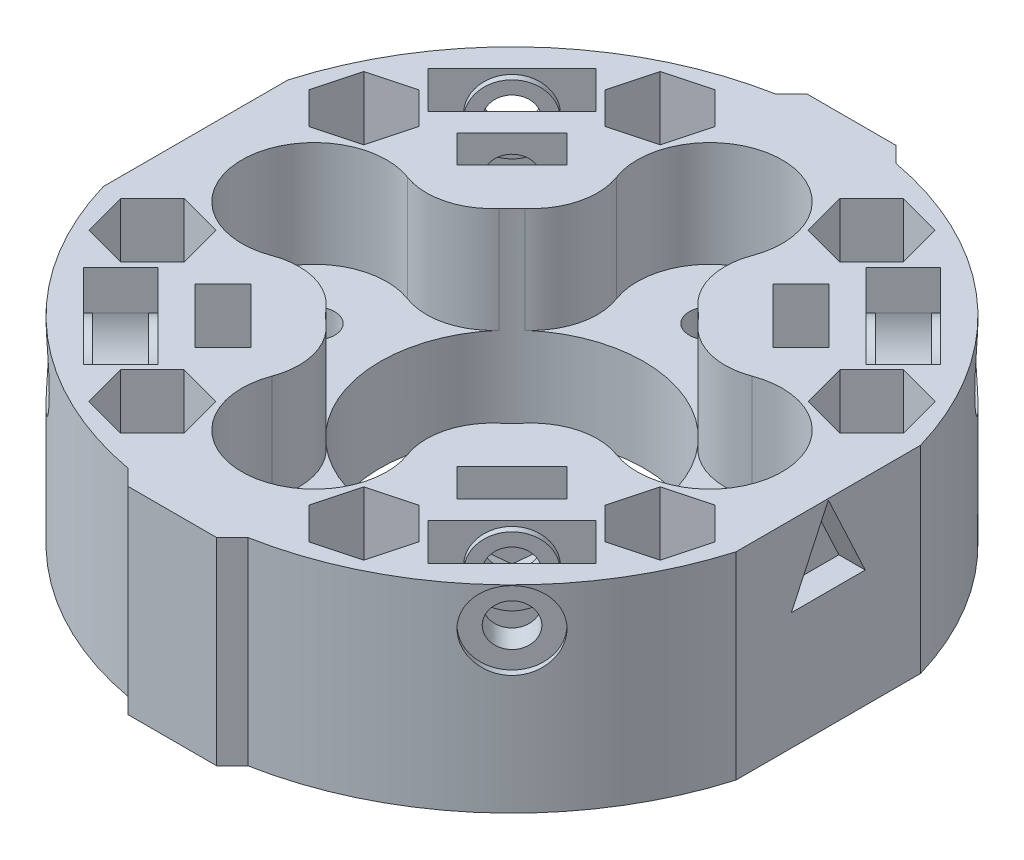
from build123d import *
from build123d.topology import SkipClean

# Parameters (mm, degrees)
SALIENTE_EXTRUIR1_DEPTH = 15
CORTAR_EXTRUIR1_DEPTH   = 4
CORTAR_EXTRUIR2_DEPTH   = 3
CROQUIS5_R              = 1.6
CORTAR_EXTRUIR3_DEPTH   = 55.319838485
CORTAR_EXTRUIR4_DEPTH   = 2
CROQUIS8_R              = 2.95
CORTAR_EXTRUIR5_DEPTH   = 3
CROQUIS10_R             = 2.6
CROQUIS10_R_2           = 1.6
SALIENTE_EXTRUIR2_DEPTH = 0.5
SALIENTE_EXTRUIR3_START = 0.5
CROQUIS11_R             = 2.6
CROQUIS11_R_2           = 1.6
SALIENTE_EXTRUIR3_DEPTH = 0.5
CROQUIS12_R             = 10
CROQUIS12_R_2           = 1.55
CORTAR_EXTRUIR6_DEPTH   = 39.276532076
CORTAR_EXTRUIR7_START   = -8
CROQUIS13_R             = 1.55
CORTAR_EXTRUIR7_DEPTH   = 8
MATRIZC1_COUNT          = 4
CROQUIS14_R             = 2.95
CORTAR_EXTRUIR8_DEPTH   = 3
MATRIZC2_COUNT          = 4
CROQUIS15_R             = 1.5
CORTAR_EXTRUIR9_DEPTH   = 5
MATRIZC3_COUNT          = 4
CROQUIS16_R             = 1.6
CORTAR_EXTRUIR10_DEPTH  = 10
CROQUIS17_R             = 1.6
CORTAR_EXTRUIR11_DEPTH  = 39.276532076
MATRIZC4_COUNT          = 4


with BuildPart() as part:
    # Croquis1 → Saliente-Extruir1 (new body)
    with BuildSketch(Plane(origin=(0, 0, 0), x_dir=(1, 0, 0), z_dir=(0, 1, 0))):
        with BuildLine():
            Line((3.36, 25.77), (-3.36, 25.77))
            Line((-3.36, 25.77), (-4.543554853, 24.583655328))
            ThreePointArc((-4.543554853, 24.583655328), (-16.762454014, 18.547779798), (-24, 7))
            Line((-24, 7), (-24, -7))
            ThreePointArc((-24, -7), (-16.762454014, -18.547779798), (-4.543554853, -24.583655328))
            Line((-4.543554853, -24.583655328), (-3.36, -25.77))
            Line((-3.36, -25.77), (3.36, -25.77))
            Line((3.36, -25.77), (4.543554853, -24.583655328))
            ThreePointArc((4.543554853, -24.583655328), (16.762454014, -18.547779798), (24, -7))
            Line((24, -7), (24, 7))
            ThreePointArc((24, 7), (16.762454014, 18.547779798), (4.543554853, 24.583655328))
            Line((4.543554853, 24.583655328), (3.36, 25.77))
        make_face()
    extrude(amount=SALIENTE_EXTRUIR1_DEPTH)

    # Croquis3 → Cortar-Extruir1 (cut)
    with BuildSketch(Plane(origin=(16.263455967, 0, -16.263455967), x_dir=(0.7071067811865477, 0, 0.7071067811865475), z_dir=(-0.7071067811865475, 0, 0.7071067811865477))):
        with BuildLine():
            Line((-4.5, 12), (-4.5, 15))
            Line((-4.5, 15), (4.5, 15))
            Line((4.5, 15), (4.5, 12))
            ThreePointArc((4.5, 12), (0, 7.5), (-4.5, 12))
        make_face()
    cortar_extruir1 = extrude(amount=CORTAR_EXTRUIR1_DEPTH, mode=Mode.SUBTRACT)

    # Croquis4 → Cortar-Extruir2 (cut)
    with BuildSketch(Plane(origin=(12.02081528, 0, -12.02081528), x_dir=(-0.7071067811865476, 0, -0.7071067811865476), z_dir=(0.7071067811865476, 0, -0.7071067811865476))):
        Polygon((-2.95, 10.296816706), (0, 8.593633412), (2.95, 10.296816706), (2.95, 13.703183294), (2.95, 15), (-2.95, 15), (-2.95, 13.703183294), align=None)
    cortar_extruir2 = extrude(amount=-CORTAR_EXTRUIR2_DEPTH, mode=Mode.SUBTRACT)

    # Croquis5 → Cortar-Extruir3 (cut, through all)
    with BuildSketch(Plane(origin=(12.02081528, 0, -12.02081528), x_dir=(0.7071067811865475, 0, 0.7071067811865477), z_dir=(-0.7071067811865477, 0, 0.7071067811865475))):
        with Locations((0, 12)):
            Circle(CROQUIS5_R)
    cortar_extruir3 = extrude(amount=-CORTAR_EXTRUIR3_DEPTH, mode=Mode.SUBTRACT)

    # Croquis6 → Cortar-Extruir4 (cut)
    with BuildSketch(Plane(origin=(24, 0, 0), x_dir=(0, 0, -1), z_dir=(1, 0, 0))):
        Polygon((0, 14.9), (-2.8, 8.9), (2.8, 8.9), align=None)
    extrude(amount=-CORTAR_EXTRUIR4_DEPTH, mode=Mode.SUBTRACT)

    # Croquis8 → Cortar-Extruir5 (cut)
    with BuildSketch(Plane(origin=(19.445436483, 0, -19.445436483), x_dir=(-0.7071067811865476, 0, -0.7071067811865476), z_dir=(0.7071067811865476, 0, -0.7071067811865476))):
        with Locations((0, 12)):
            Circle(CROQUIS8_R)
    cortar_extruir5 = extrude(amount=-CORTAR_EXTRUIR5_DEPTH, mode=Mode.SUBTRACT)

    # Croquis10 → Saliente-Extruir2 (add)
    with BuildSketch(Plane(origin=(13.435028843, 0, -13.435028843), x_dir=(-0.7071067811865476, 0, -0.7071067811865476), z_dir=(0.7071067811865476, 0, -0.7071067811865476))):
        with Locations(Location((0, 12, 0), (0, 0, 180))):
            Circle(CROQUIS10_R)
        with Locations(Location((0, 12, 0), (0, 0, 180))):
            Circle(CROQUIS10_R_2, mode=Mode.SUBTRACT)
    saliente_extruir2 = extrude(amount=SALIENTE_EXTRUIR2_DEPTH)

    # Croquis11 → Saliente-Extruir3 (add)
    with BuildSketch(Plane(origin=(16.263455967, 0, -16.263455967), x_dir=(0.7071067811865476, 0, 0.7071067811865476), z_dir=(-0.7071067811865476, 0, 0.7071067811865476)).offset(SALIENTE_EXTRUIR3_START)):
        with Locations((0, 12)):
            Circle(CROQUIS11_R)
        with Locations((0, 12)):
            Circle(CROQUIS11_R_2, mode=Mode.SUBTRACT)
    saliente_extruir3 = extrude(amount=-SALIENTE_EXTRUIR3_DEPTH)

    # Croquis12 → Cortar-Extruir6 (cut, through all)
    with BuildSketch(Plane.XZ):
        with Locations(Location((0, 0, 0), (0, 0, 270))):
            Circle(CROQUIS12_R)
        with Locations(Location((0, -15, 0), (0, 0, 270))):
            Circle(CROQUIS12_R_2)
        with Locations(Location((-15, 0, 0), (0, 0, 270))):
            Circle(CROQUIS12_R_2)
        with Locations(Location((0, 15, 0), (0, 0, 270))):
            Circle(CROQUIS12_R_2)
        with Locations(Location((15, 0, 0), (0, 0, 270))):
            Circle(CROQUIS12_R_2)
    extrude(amount=-CORTAR_EXTRUIR6_DEPTH, mode=Mode.SUBTRACT)

    # Croquis13 → Cortar-Extruir7 (cut)
    # profile 1 of 5: a face of its own
    with SkipClean():  # the faces are left unmerged after this step: merging them gives an invalid solid
        with BuildSketch(Plane(origin=(0, 15, 0), x_dir=(1, 0, 0), z_dir=(0, 1, 0)).offset(CORTAR_EXTRUIR7_START)):
            with BuildLine():
                ThreePointArc((-6.557247898, 7.55), (0, 10), (6.557247898, 7.55))
                ThreePointArc((6.557247898, 7.55), (4.990126291, 10.092624246), (5.152123349, 13.075))
                ThreePointArc((5.152123349, 13.075), (0, 20.5), (-5.152123349, 13.075))
                ThreePointArc((-5.152123349, 13.075), (-4.990126291, 10.092624246), (-6.557247898, 7.55))
            make_face()
            with Locations(Location((0, 15, 0), (0, 0, 90))):
                Circle(CROQUIS13_R, mode=Mode.SUBTRACT)
        # profile 2 of 5: a face of its own
        with BuildSketch(Plane(origin=(0, 15, 0), x_dir=(1, 0, 0), z_dir=(0, 1, 0)).offset(CORTAR_EXTRUIR7_START)):
            with BuildLine():
                ThreePointArc((6.557247898, -7.55), (7.071067812, -7.071067812), (7.55, -6.557247898))
                ThreePointArc((7.55, -6.557247898), (9.367496998, -3.5), (10, 0))
                ThreePointArc((10, 0), (9.367496998, 3.5), (7.55, 6.557247898))
                ThreePointArc((7.55, 6.557247898), (7.071067812, 7.071067812), (6.557247898, 7.55))
                ThreePointArc((6.557247898, 7.55), (0, 10), (-6.557247898, 7.55))
                ThreePointArc((-6.557247898, 7.55), (-7.071067812, 7.071067812), (-7.55, 6.557247898))
                ThreePointArc((-7.55, 6.557247898), (-10, 0), (-7.55, -6.557247898))
                ThreePointArc((-7.55, -6.557247898), (-7.071067812, -7.071067812), (-6.557247898, -7.55))
                ThreePointArc((-6.557247898, -7.55), (0, -10), (6.557247898, -7.55))
            make_face()
        # profile 3 of 5: a face of its own
        with BuildSketch(Plane(origin=(0, 15, 0), x_dir=(1, 0, 0), z_dir=(0, 1, 0)).offset(CORTAR_EXTRUIR7_START)):
            with BuildLine():
                ThreePointArc((5.152123349, -13.075), (4.990126291, -10.092624246), (6.557247898, -7.55))
                ThreePointArc((6.557247898, -7.55), (0, -10), (-6.557247898, -7.55))
                ThreePointArc((-6.557247898, -7.55), (-4.990126291, -10.092624246), (-5.152123349, -13.075))
                ThreePointArc((-5.152123349, -13.075), (0, -20.5), (5.152123349, -13.075))
            make_face()
            with Locations(Location((0, -15, 0), (0, 0, 90))):
                Circle(CROQUIS13_R, mode=Mode.SUBTRACT)
        # profile 4 of 5: a face of its own
        with BuildSketch(Plane(origin=(0, 15, 0), x_dir=(1, 0, 0), z_dir=(0, 1, 0)).offset(CORTAR_EXTRUIR7_START)):
            with BuildLine():
                ThreePointArc((-13.075, -5.152123349), (-10.092624246, -4.990126291), (-7.55, -6.557247898))
                ThreePointArc((-7.55, -6.557247898), (-10, 0), (-7.55, 6.557247898))
                ThreePointArc((-7.55, 6.557247898), (-10.092624246, 4.990126291), (-13.075, 5.152123349))
                ThreePointArc((-13.075, 5.152123349), (-20.5, 0), (-13.075, -5.152123349))
            make_face()
            with Locations(Location((-15, 0, 0), (0, 0, 90))):
                Circle(CROQUIS13_R, mode=Mode.SUBTRACT)
        # profile 5 of 5: a face of its own
        with BuildSketch(Plane(origin=(0, 15, 0), x_dir=(1, 0, 0), z_dir=(0, 1, 0)).offset(CORTAR_EXTRUIR7_START)):
            with BuildLine():
                ThreePointArc((7.55, -6.557247898), (10.092624246, -4.990126291), (13.075, -5.152123349))
                ThreePointArc((13.075, -5.152123349), (20.5, 0), (13.075, 5.152123349))
                ThreePointArc((13.075, 5.152123349), (10.092624246, 4.990126291), (7.55, 6.557247898))
                ThreePointArc((7.55, 6.557247898), (9.367496998, 3.5), (10, 0))
                ThreePointArc((10, 0), (9.367496998, -3.5), (7.55, -6.557247898))
            make_face()
            with Locations(Location((15, 0, 0), (0, 0, 90))):
                Circle(CROQUIS13_R, mode=Mode.SUBTRACT)
        extrude(amount=CORTAR_EXTRUIR7_DEPTH, mode=Mode.SUBTRACT)

    # MatrizC1: Cortar-Extruir1, Cortar-Extruir2, Cortar-Extruir3, Cortar-Extruir5, Saliente-Extruir2, Saliente-Extruir3 ×4 about axis
    with SkipClean():  # the faces are left unmerged after this step: merging them gives an invalid solid
        matrizc1_axis = Axis((0, 0, 0), (0, 1, 0))
        add([cortar_extruir1.rotate(matrizc1_axis, i * 360 / MATRIZC1_COUNT) for i in range(1, MATRIZC1_COUNT)], mode=Mode.SUBTRACT)
        add([cortar_extruir2.rotate(matrizc1_axis, i * 360 / MATRIZC1_COUNT) for i in range(1, MATRIZC1_COUNT)], mode=Mode.SUBTRACT)
        add([cortar_extruir3.rotate(matrizc1_axis, i * 360 / MATRIZC1_COUNT) for i in range(1, MATRIZC1_COUNT)], mode=Mode.SUBTRACT)
        add([cortar_extruir5.rotate(matrizc1_axis, i * 360 / MATRIZC1_COUNT) for i in range(1, MATRIZC1_COUNT)], mode=Mode.SUBTRACT)
        add([saliente_extruir2.rotate(matrizc1_axis, i * 360 / MATRIZC1_COUNT) for i in range(1, MATRIZC1_COUNT)])
        add([saliente_extruir3.rotate(matrizc1_axis, i * 360 / MATRIZC1_COUNT) for i in range(1, MATRIZC1_COUNT)])

    # Croquis14 → Cortar-Extruir8 (cut)
    with SkipClean():  # the faces are left unmerged after this step: merging them gives an invalid solid
        with BuildSketch(Plane.XZ):
            with Locations(Location((0, -15, 0), (0, 0, 270))):
                Circle(CROQUIS14_R)
        cortar_extruir8 = extrude(amount=-CORTAR_EXTRUIR8_DEPTH, mode=Mode.SUBTRACT)

    # MatrizC2: Cortar-Extruir8 ×4 about axis
    with SkipClean():  # the faces are left unmerged after this step: merging them gives an invalid solid
        matrizc2_axis = Axis((0, 0, 0), (0, 1, 0))
        for i in range(1, MATRIZC2_COUNT):
            add(cortar_extruir8.rotate(matrizc2_axis, i * 360 / MATRIZC2_COUNT), mode=Mode.SUBTRACT)

    # Croquis15 → Cortar-Extruir9 (cut)
    with SkipClean():  # the faces are left unmerged after this step: merging them gives an invalid solid
        with BuildSketch(Plane.XZ):
            with Locations(Location((-10.606601718, 10.606601718, 0), (0, 0, 270))):
                Circle(CROQUIS15_R)
        cortar_extruir9 = extrude(amount=-CORTAR_EXTRUIR9_DEPTH, mode=Mode.SUBTRACT)

    # MatrizC3: Cortar-Extruir9 ×4 about axis
    with SkipClean():  # the faces are left unmerged after this step: merging them gives an invalid solid
        matrizc3_axis = Axis((0, 0, 0), (0, 1, 0))
        for i in range(1, MATRIZC3_COUNT):
            add(cortar_extruir9.rotate(matrizc3_axis, i * 360 / MATRIZC3_COUNT), mode=Mode.SUBTRACT)

    # Croquis16 → Cortar-Extruir10 (cut)
    # profile 1 of 2: a face of its own
    with SkipClean():  # the faces are left unmerged after this step: merging them gives an invalid solid
        with BuildSketch(Plane(origin=(0, 15, 0), x_dir=(1, 0, 0), z_dir=(0, 1, 0))):
            Polygon((-4.733113576, 20.148041406), (-7.14177849, 22.55670632), (-10.432075951, 21.675073772), (-11.313708499, 18.384776311), (-8.905043585, 15.976111397), (-5.614746124, 16.857743945), align=None)
            with Locations(Location((-8.023411038, 19.266408858, 0), (0, 0, 270))):
                Circle(CROQUIS16_R, mode=Mode.SUBTRACT)
        # profile 2 of 2: a face of its own
        with BuildSketch(Plane(origin=(0, 15, 0), x_dir=(1, 0, 0), z_dir=(0, 1, 0))):
            Polygon((-18.384776311, 11.313708499), (-21.675073772, 10.432075951), (-22.55670632, 7.14177849), (-20.148041406, 4.733113576), (-16.857743945, 5.614746124), (-15.976111397, 8.905043585), align=None)
            with Locations(Location((-19.266408858, 8.023411038, 0), (0, 0, 270))):
                Circle(CROQUIS16_R, mode=Mode.SUBTRACT)
        cortar_extruir10 = extrude(amount=-CORTAR_EXTRUIR10_DEPTH, mode=Mode.SUBTRACT)

    # Croquis17 → Cortar-Extruir11 (cut, through all)
    with SkipClean():  # the faces are left unmerged after this step: merging them gives an invalid solid
        with BuildSketch(Plane(origin=(0, 15, 0), x_dir=(1, 0, 0), z_dir=(0, 1, 0))):
            with Locations(Location((-19.266408858, 8.023411038, 0), (0, 0, 270))):
                Circle(CROQUIS17_R)
            with Locations(Location((-8.023411038, 19.266408858, 0), (0, 0, 270))):
                Circle(CROQUIS17_R)
        cortar_extruir11 = extrude(amount=-CORTAR_EXTRUIR11_DEPTH, mode=Mode.SUBTRACT)

    # MatrizC4: Cortar-Extruir10, Cortar-Extruir11 ×4 about axis
    with SkipClean():  # the faces are left unmerged after this step: merging them gives an invalid solid
        matrizc4_axis = Axis((0, 0, 0), (0, 1, 0))
        add([cortar_extruir10.rotate(matrizc4_axis, i * 360 / MATRIZC4_COUNT) for i in range(1, MATRIZC4_COUNT)], mode=Mode.SUBTRACT)
        add([cortar_extruir11.rotate(matrizc4_axis, i * 360 / MATRIZC4_COUNT) for i in range(1, MATRIZC4_COUNT)], mode=Mode.SUBTRACT)


solid = part.part
